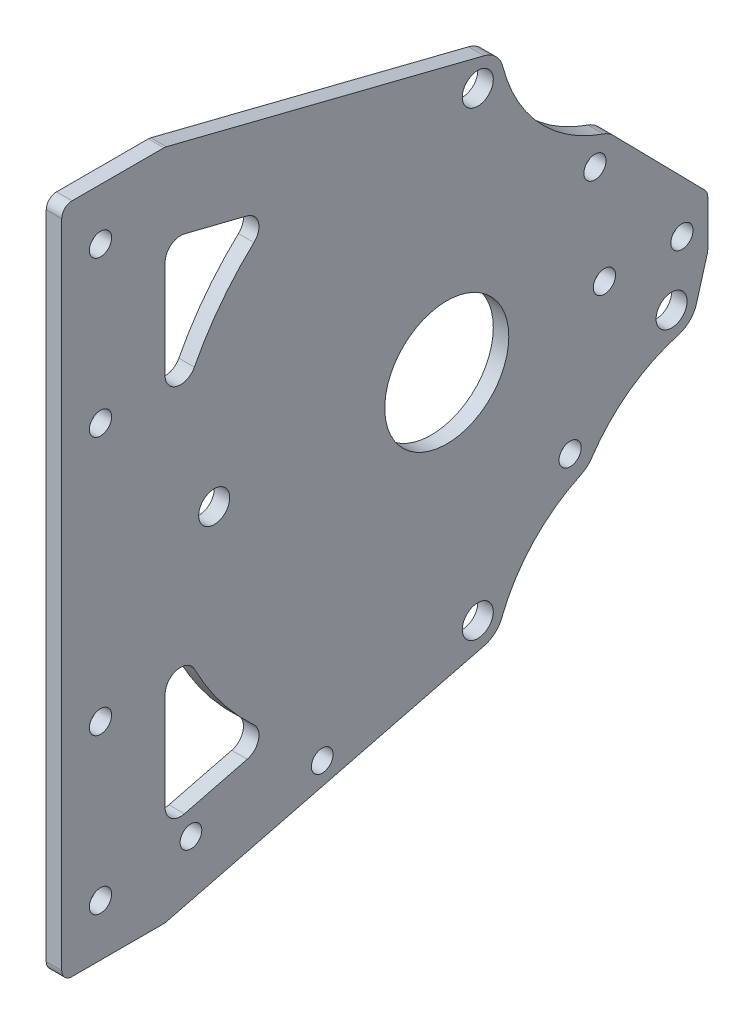
from build123d import *

# Parameters (mm, degrees)
SKETCH_1_R          = 2.15
SKETCH_1_R_2        = 12
SKETCH_1_R_3        = 3
SKETCH_1_R_4        = 2.1
EXTRUDE_1_DEPTH     = 3
CUT_EXTRUDE_1_DEPTH = 3
FILLET_1_R          = 2
FILLET_2_R          = 2
FILLET_3_R          = 3


with BuildPart() as part:
    # ｽｹｯﾁ1 → ﾎﾞｽ - 押し出し1 (new body)
    with BuildSketch(Plane(origin=(0, 0, 0), x_dir=(0, 0, -1), z_dir=(1, 0, 0))):
        with BuildLine():
            Line((0, 0), (20, 0))
            Line((20, 0), (81.721631315, 15.55153458))
            ThreePointArc((81.721631315, 15.55153458), (83.805915962, 16.648877548), (85.156498305, 18.57873024))
            ThreePointArc((85.156498305, 18.57873024), (91.240951268, 28.202978223), (100.473591964, 34.86669062))
            ThreePointArc((100.473591964, 34.86669062), (101.625387424, 35.607613327), (102.53294649, 36.633252532))
            ThreePointArc((102.53294649, 36.633252532), (109.848876527, 44.266796828), (119.358709974, 48.888149295))
            ThreePointArc((119.358709974, 48.888149295), (121.530071674, 50.159012288), (122.807632728, 52.326439826))
            Line((122.807632728, 52.326439826), (125, 60))
            Line((125, 60), (125, 70))
            Line((125, 70), (106.736076333, 88.580227744))
            ThreePointArc((106.736076333, 88.580227744), (105.828986144, 89.309735766), (104.777796911, 89.809731531))
            ThreePointArc((104.777796911, 89.809731531), (92.392887273, 97.853140314), (85.346092725, 110.831009869))
            ThreePointArc((85.346092725, 110.831009869), (84.032111964, 113.138952539), (81.721631315, 114.44846542))
            Line((81.721631315, 114.44846542), (20, 130))
            Line((20, 130), (0, 130))
            Line((0, 130), (0, 0))
        make_face()
        with Locations((7.5, 120)):
            Circle(SKETCH_1_R, mode=Mode.SUBTRACT)
        with Locations((7.5, 90)):
            Circle(SKETCH_1_R, mode=Mode.SUBTRACT)
        with Locations(Location((7.5, 40, 0), (0, 0, 180))):
            Circle(SKETCH_1_R, mode=Mode.SUBTRACT)
        with Locations(Location((7.5, 10, 0), (0, 0, 180))):
            Circle(SKETCH_1_R, mode=Mode.SUBTRACT)
        with Locations((74.5, 65)):
            Circle(SKETCH_1_R_2, mode=Mode.SUBTRACT)
        with Locations((29.5, 65)):
            Circle(SKETCH_1_R_3, mode=Mode.SUBTRACT)
        with Locations((80.5, 20.4)):
            Circle(SKETCH_1_R_3, mode=Mode.SUBTRACT)
        with Locations((118, 53.7)):
            Circle(SKETCH_1_R_3, mode=Mode.SUBTRACT)
        with Locations((80.5, 109.6)):
            Circle(SKETCH_1_R_3, mode=Mode.SUBTRACT)
        with Locations((103.17032155, 85.075175272)):
            Circle(SKETCH_1_R, mode=Mode.SUBTRACT)
        with Locations((98.369942602, 39.402620443)):
            Circle(SKETCH_1_R, mode=Mode.SUBTRACT)
        with Locations((105, 65)):
            Circle(SKETCH_1_R, mode=Mode.SUBTRACT)
        with Locations((120, 65)):
            Circle(SKETCH_1_R, mode=Mode.SUBTRACT)
        with Locations((25, 12)):
            Circle(SKETCH_1_R_4, mode=Mode.SUBTRACT)
        with Locations((50.4, 12)):
            Circle(SKETCH_1_R_4, mode=Mode.SUBTRACT)
    extrude(amount=EXTRUDE_1_DEPTH)

    # ｽｹｯﾁ2 → ｶｯﾄ - 押し出し1 (cut)
    with BuildSketch(Plane(origin=(3, 0, 0), x_dir=(0, 0, -1), z_dir=(1, 0, 0))):
        with BuildLine():
            Line((20, 114.531188015), (20, 72.399324293))
            ThreePointArc((20, 72.399324293), (27.112840869, 92.918759813), (41.614001532, 109.085270837))
            Line((41.614001532, 109.085270837), (20, 114.531188015))
        make_face()
        with BuildLine():
            Line((20, 15.468811985), (41.614001532, 20.914729163))
            ThreePointArc((41.614001532, 20.914729163), (27.112840869, 37.081240187), (20, 57.600675707))
            Line((20, 57.600675707), (20, 15.468811985))
        make_face()
    extrude(amount=-CUT_EXTRUDE_1_DEPTH, mode=Mode.SUBTRACT)

    # ﾌｨﾚｯﾄ1
    fillet_1_edges = [part.edges().sort_by_distance(p)[0] for p in [
        (1.5, 130, 0),
        (1.5, 130, -20),
        (1.5, 0, -20),
        (1.5, 0, 0),
    ]]
    fillet(fillet_1_edges, radius=FILLET_1_R)

    # ﾌｨﾚｯﾄ2
    fillet_2_edges = [part.edges().sort_by_distance(p)[0] for p in [
        (1.5, 70, -125),
        (1.5, 60, -125),
    ]]
    fillet(fillet_2_edges, radius=FILLET_2_R)

    # ﾌｨﾚｯﾄ3
    fillet_3_edges = [part.edges().sort_by_distance(p)[0] for p in [
        (1.5, 114.531188015, -20),
        (1.5, 109.085270837, -41.614001532),
        (1.5, 72.399324293, -20),
        (1.5, 15.468811985, -20),
        (1.5, 57.600675707, -20),
        (1.5, 20.914729163, -41.614001532),
    ]]
    fillet(fillet_3_edges, radius=FILLET_3_R)


solid = part.part
